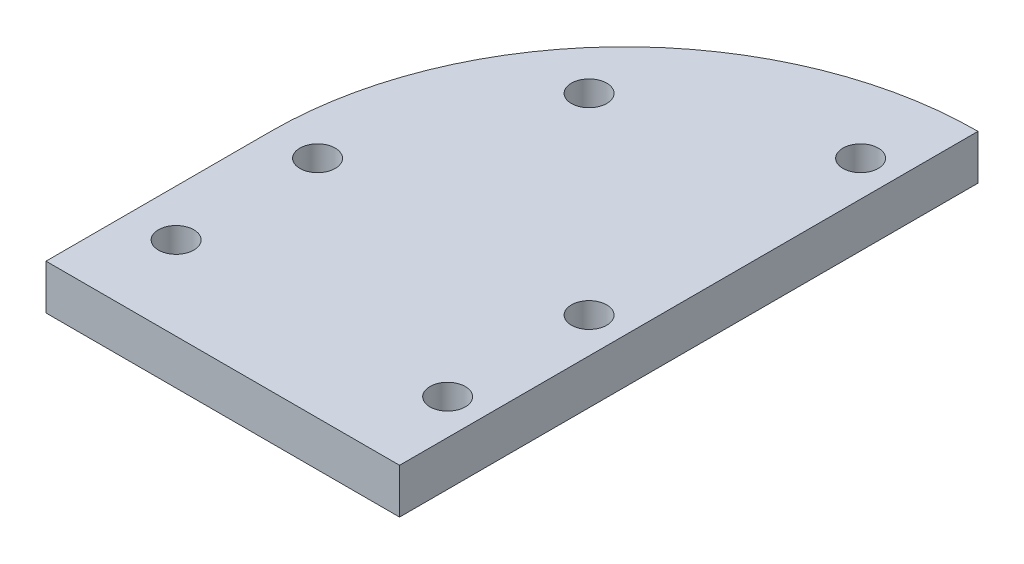
from build123d import *

# Parameters (mm, degrees)
SKETCH2_R           = 2.5
BOSS_EXTRUDE1_DEPTH = 6.35


with BuildPart() as part:
    # Sketch2 → Boss-Extrude1 (new body)
    with BuildSketch(Plane(origin=(0, 0, 0), x_dir=(1, 0, 0), z_dir=(0, 1, 0))):
        with BuildLine():
            Line((50, 31.8), (50, 81.8))
            ThreePointArc((50, 81.8), (14.644660941, 67.155339059), (0, 31.8))
            Line((0, 31.8), (0, 0))
            Line((0, 0), (50, 0))
            Line((50, 0), (50, 31.8))
        make_face()
        with Locations(Location((45, 31.8, 0), (0, 0, 270))):
            Circle(SKETCH2_R, mode=Mode.SUBTRACT)
        with Locations(Location((6.6, 31.8, 0), (0, 0, 270))):
            Circle(SKETCH2_R, mode=Mode.SUBTRACT)
        with Locations(Location((17.847099602, 58.952900398, 0), (0, 0, 270))):
            Circle(SKETCH2_R, mode=Mode.SUBTRACT)
        with Locations(Location((45, 70.2, 0), (0, 0, 270))):
            Circle(SKETCH2_R, mode=Mode.SUBTRACT)
        with Locations(Location((6.6, 11.8, 0), (0, 0, 270))):
            Circle(SKETCH2_R, mode=Mode.SUBTRACT)
        with Locations(Location((45, 11.8, 0), (0, 0, 270))):
            Circle(SKETCH2_R, mode=Mode.SUBTRACT)
    extrude(amount=BOSS_EXTRUDE1_DEPTH)


solid = part.part
